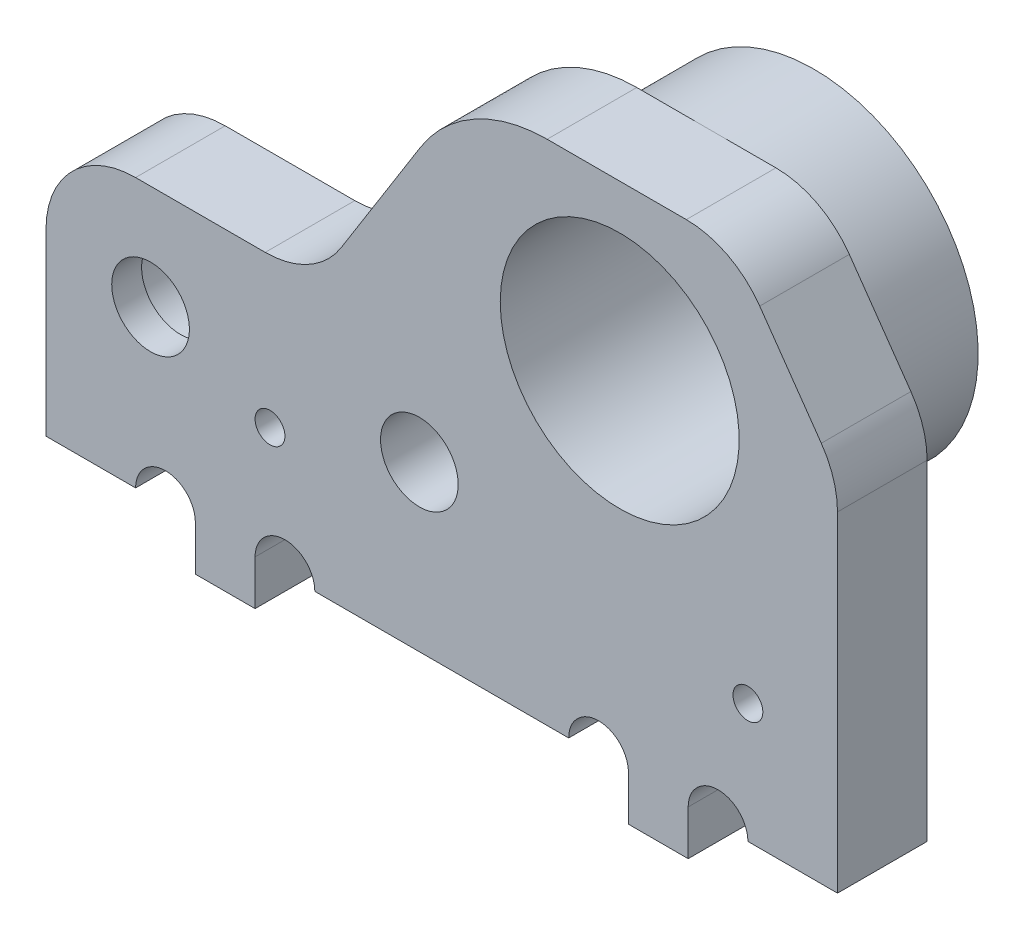
from build123d import *

# Parameters (mm, degrees)
SKETCH1_W                            = 26.5
SKETCH1_H                            = 6
BOSS_EXTRUDE1_DEPTH                  = 17
SKETCH2_R                            = 1.5
CUT_EXTRUDE1_DEPTH                   = 1
SKETCH3_R                            = 1.3
CUT_EXTRUDE2_DEPTH                   = 32.878676259
SKETCH4_R                            = 4
CUT_EXTRUDE3_DEPTH                   = 33.050741021
SKETCH5_R                            = 2.5
CUT_EXTRUDE4_DEPTH                   = 1.5
SKETCH6_R                            = 1.5
CUT_EXTRUDE8_DEPTH                   = 1
SKETCH7_R                            = 1.3
CUT_EXTRUDE9_DEPTH                   = 32.678068123
CUT_EXTRUDE10_START                  = -1
SKETCH8_R                            = 2.5
CUT_EXTRUDE10_DEPTH                  = 1
CUT_EXTRUDE11_START                  = -1
SKETCH9_R                            = 1.5
CUT_EXTRUDE11_DEPTH                  = 1
SKETCH10_R                           = 5.5
SKETCH10_R_2                         = 4
BOSS_EXTRUDE2_DEPTH                  = 3.5
SKETCH11_R                           = 3
SKETCH11_R_2                         = 1.3
BOSS_EXTRUDE4_DEPTH                  = 2
CUT_EXTRUDE12_START                  = -1
SKETCH12_R                           = 1.5
CUT_EXTRUDE12_DEPTH                  = 1
SKETCH17_W                           = 2
SKETCH17_H                           = 6
BOSS_EXTRUDE6_DEPTH                  = 1.5
SKETCH18_R                           = 1
CUT_EXTRUDE17_DEPTH                  = 33.050741021
CHAMFER2_SIZE                        = 5
CHAMFER2_SIZE2                       = 3.5
FILLET11_R                           = 3
BOSS_EXTRUDE7_DEPTH                  = 2
CUT_EXTRUDE19_DEPTH                  = 33.050741021
FILLET13_R                           = 5
FILLET14_R                           = 3
FILLET15_R                           = 3
SKIZZE1_R                            = 0.5
SCHNITT_LINEAR_AUSTRAGEN1_DEPTH      = 33.050741021
SCHNITT_LINEAR_AUSTRAGEN2_DEPTH      = 31.409702399
SCHNITT_LINEAR_AUSTRAGEN2_DEPTH_BACK = 31.409702399
SKIZZE2_W                            = 26.5
SKIZZE2_H                            = 3


with BuildPart() as part:
    # Sketch1 → Boss-Extrude1 (new body)
    with BuildSketch(Plane(origin=(0, 0, 0), x_dir=(1, 0, 0), z_dir=(0, 1, 0))):
        with Locations((13.25, 3)):
            Rectangle(SKETCH1_W, SKETCH1_H)
    extrude(amount=BOSS_EXTRUDE1_DEPTH)

    # Sketch2 → Cut-Extrude1 (cut)
    with BuildSketch(Plane.XY):
        with Locations((12.5, 5.5)):
            Circle(SKETCH2_R)
    extrude(amount=-CUT_EXTRUDE1_DEPTH, mode=Mode.SUBTRACT)

    # Sketch3 → Cut-Extrude2 (cut, through all)
    with BuildSketch(Plane.XY.offset(-1)):
        with Locations((12.5, 5.5)):
            Circle(SKETCH3_R)
    extrude(amount=-CUT_EXTRUDE2_DEPTH, mode=Mode.SUBTRACT)

    # Sketch4 → Cut-Extrude3 (cut, through all)
    with BuildSketch(Plane.XY):
        with Locations((19.208203932, 11.5)):
            Circle(SKETCH4_R)
    extrude(amount=-CUT_EXTRUDE3_DEPTH, mode=Mode.SUBTRACT)

    # Sketch5 → Cut-Extrude4 (cut)
    with BuildSketch(Plane.XY):
        with Locations((3.5, 5.5)):
            Circle(SKETCH5_R)
    extrude(amount=-CUT_EXTRUDE4_DEPTH, mode=Mode.SUBTRACT)

    # Sketch6 → Cut-Extrude8 (cut)
    with BuildSketch(Plane.XY.offset(-1.5)):
        with Locations((3.5, 5.5)):
            Circle(SKETCH6_R)
    extrude(amount=-CUT_EXTRUDE8_DEPTH, mode=Mode.SUBTRACT)

    # Sketch7 → Cut-Extrude9 (cut, through all)
    with BuildSketch(Plane.XY.offset(-2.5)):
        with Locations((3.5, 5.5)):
            Circle(SKETCH7_R)
    extrude(amount=-CUT_EXTRUDE9_DEPTH, mode=Mode.SUBTRACT)

    # Sketch8 → Cut-Extrude10 (cut)
    with BuildSketch(Plane(origin=(0, 0, -6), x_dir=(-1, 0, 0), z_dir=(0, 0, -1)).offset(CUT_EXTRUDE10_START)):
        with Locations(Location((-3.5, 5.5, 0), (0, 0, 180))):
            Circle(SKETCH8_R)
    extrude(amount=CUT_EXTRUDE10_DEPTH, mode=Mode.SUBTRACT)

    # Sketch9 → Cut-Extrude11 (cut)
    with BuildSketch(Plane(origin=(0, 0, -5), x_dir=(-1, 0, 0), z_dir=(0, 0, -1)).offset(CUT_EXTRUDE11_START)):
        with Locations(Location((-3.5, 5.5, 0), (0, 0, 180))):
            Circle(SKETCH9_R)
    extrude(amount=CUT_EXTRUDE11_DEPTH, mode=Mode.SUBTRACT)

    # Sketch10 → Boss-Extrude2 (add)
    with BuildSketch(Plane(origin=(0, 0, -6), x_dir=(-1, 0, 0), z_dir=(0, 0, -1))):
        with Locations(Location((-19.208203932, 11.5, 0), (0, 0, 90))):
            Circle(SKETCH10_R)
        with Locations(Location((-19.208203932, 11.5, 0), (0, 0, 180))):
            Circle(SKETCH10_R_2, mode=Mode.SUBTRACT)
    extrude(amount=BOSS_EXTRUDE2_DEPTH)

    # Sketch11 → Boss-Extrude4 (add)
    with BuildSketch(Plane(origin=(0, 0, -6), x_dir=(-1, 0, 0), z_dir=(0, 0, -1))):
        with Locations(Location((-12.5, 5.5, 0), (0, 0, 180))):
            Circle(SKETCH11_R)
        with Locations(Location((-12.5, 5.5, 0), (0, 0, 180))):
            Circle(SKETCH11_R_2, mode=Mode.SUBTRACT)
    extrude(amount=BOSS_EXTRUDE4_DEPTH)

    # Sketch12 → Cut-Extrude12 (cut)
    with BuildSketch(Plane(origin=(0, 0, -8), x_dir=(-1, 0, 0), z_dir=(0, 0, -1)).offset(CUT_EXTRUDE12_START)):
        with Locations(Location((-12.5, 5.5, 0), (0, 0, 180))):
            Circle(SKETCH12_R)
    extrude(amount=CUT_EXTRUDE12_DEPTH, mode=Mode.SUBTRACT)

    # Sketch17 → Boss-Extrude6 (add)
    with BuildSketch(Plane.XZ):
        with Locations((6, -3)):
            Rectangle(SKETCH17_W, SKETCH17_H)
        with Locations((20.5, -3)):
            Rectangle(SKETCH17_W, SKETCH17_H)
    extrude(amount=BOSS_EXTRUDE6_DEPTH)

    # Sketch18 → Cut-Extrude17 (cut, through all)
    with BuildSketch(Plane(origin=(0, 0, -6), x_dir=(-1, 0, 0), z_dir=(0, 0, -1))):
        with Locations((-22.5, 0)):
            Circle(SKETCH18_R)
        with Locations((-18.5, 0)):
            Circle(SKETCH18_R)
        with Locations((-8, 0)):
            Circle(SKETCH18_R)
        with Locations((-4, 0)):
            Circle(SKETCH18_R)
    extrude(amount=-CUT_EXTRUDE17_DEPTH, mode=Mode.SUBTRACT)

    # Chamfer2
    chamfer2_edges = [part.edges().sort_by_distance(p)[0] for p in [
        (26.5, 17, -3),
    ]]
    chamfer2_side = [part.faces().sort_by_distance(p)[0] for p in [
        (26.5, 8.5, -3),
    ]]
    chamfer(chamfer2_edges, length=CHAMFER2_SIZE, length2=CHAMFER2_SIZE2, reference=chamfer2_side[0])

    # Fillet11
    fillet11_edges = [part.edges().sort_by_distance(p)[0] for p in [
        (23, 17, -3),
        (26.5, 12, -3),
    ]]
    fillet(fillet11_edges, radius=FILLET11_R)

    # Sketch19 → Boss-Extrude7 (add)
    with BuildSketch(Plane(origin=(0, 0, -6), x_dir=(-1, 0, 0), z_dir=(0, 0, -1))):
        with BuildLine():
            Line((-14.547099294, 14.419606745), (-9.957579288, 7.09251277))
            ThreePointArc((-9.957579288, 7.09251277), (-14.736067977, 7.5), (-13.800160725, 2.796376119))
            Line((-13.800160725, 2.796376119), (-21.591831928, 6.543356218))
            ThreePointArc((-21.591831928, 6.543356218), (-15.108745974, 7.833333333), (-14.547099294, 14.419606745))
        make_face()
    extrude(amount=BOSS_EXTRUDE7_DEPTH)

    # Sketch20 → Cut-Extrude19 (cut, through all)
    with BuildSketch(Plane(origin=(0, 0, -6), x_dir=(-1, 0, 0), z_dir=(0, 0, -1))):
        Polygon((0, 17), (-14.011012575, 17), (-9, 9), (0, 9), align=None)
    extrude(amount=-CUT_EXTRUDE19_DEPTH, mode=Mode.SUBTRACT)

    # Fillet13
    fillet13_edges = [part.edges().sort_by_distance(p)[0] for p in [
        (14.011012575, 17, -3),
    ]]
    fillet(fillet13_edges, radius=FILLET13_R)

    # Fillet14
    fillet14_edges = [part.edges().sort_by_distance(p)[0] for p in [
        (9, 9, -3),
    ]]
    fillet(fillet14_edges, radius=FILLET14_R)

    # Fillet15
    fillet15_edges = [part.edges().sort_by_distance(p)[0] for p in [
        (0, 9, -3),
    ]]
    fillet(fillet15_edges, radius=FILLET15_R)

    # Skizze1 → Schnitt-Linear austragen1 (cut, through all)
    with BuildSketch(Plane(origin=(0, 0, -6), x_dir=(-1, 0, 0), z_dir=(0, 0, -1))):
        with Locations((-23.5, 4)):
            Circle(SKIZZE1_R)
        with Locations((-7.5, 4)):
            Circle(SKIZZE1_R)
    extrude(amount=-SCHNITT_LINEAR_AUSTRAGEN1_DEPTH, mode=Mode.SUBTRACT)

    # Skizze2 → Schnitt-Linear austragen2 (cut, two sides: drawn at the far end of the back side and taken through both)
    with BuildSketch(Plane(origin=(0, 5.5, 0), x_dir=(1, 0, 0), z_dir=(0, 1, 0)).offset(-SCHNITT_LINEAR_AUSTRAGEN2_DEPTH_BACK)):
        with Locations((13.25, 1.5)):
            Rectangle(SKIZZE2_W, SKIZZE2_H)
    extrude(amount=SCHNITT_LINEAR_AUSTRAGEN2_DEPTH + SCHNITT_LINEAR_AUSTRAGEN2_DEPTH_BACK, mode=Mode.SUBTRACT)


solid = part.part
